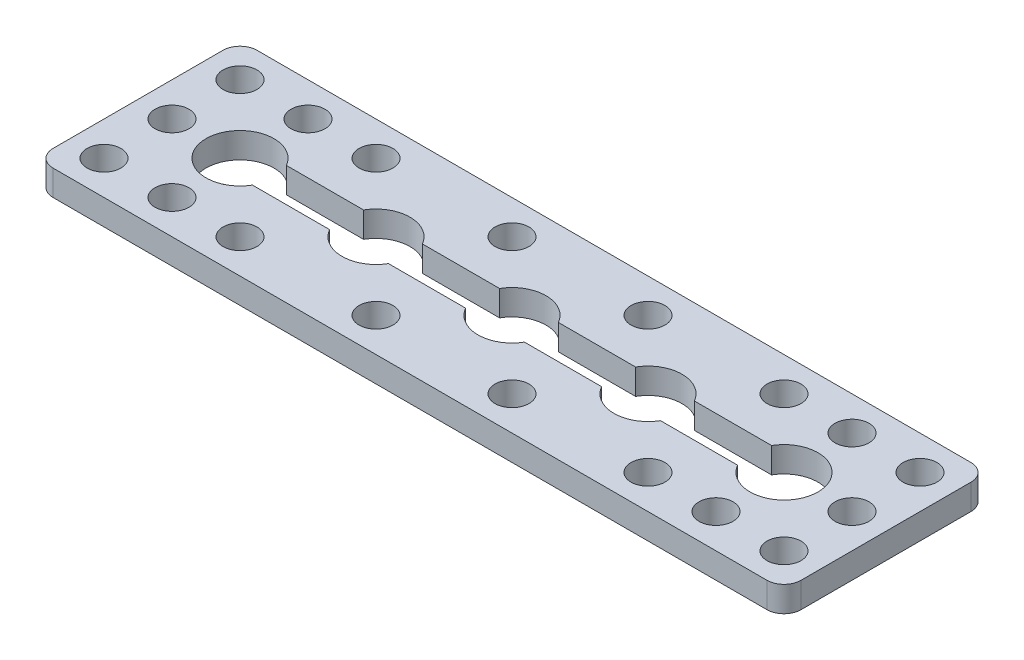
from build123d import *

# Parameters (mm, degrees)
SKETCH1_R           = 2
BOSS_EXTRUDE1_DEPTH = 3


with BuildPart() as part:
    # Sketch1 → Boss-Extrude1 (new body)
    # profile 1 of 4: a face of its own
    with BuildSketch(Plane(origin=(0, 0, 0), x_dir=(1, 0, 0), z_dir=(0, 1, 0))):
        with BuildLine():
            Line((-30.480543451, -12.568481461), (11.519456549, -12.568481461))
            Line((11.519456549, -12.568481461), (11.519456549, -4.568481461))
            ThreePointArc((11.519456549, -4.568481461), (9.519456549, -4.032583076), (8.055354934, -2.568481461))
            Line((8.055354934, -2.568481461), (-1.016441836, -2.568481461))
            ThreePointArc((-1.016441836, -2.568481461), (-4.480543451, -4.568481461), (-7.944645066, -2.568481461))
            Line((-7.944645066, -2.568481461), (-17.016441836, -2.568481461))
            ThreePointArc((-17.016441836, -2.568481461), (-21.515819631, -4.432184766), (-24.480543451, -0.568481461))
            Line((-24.480543451, -0.568481461), (-26.480543451, -0.568481461))
            ThreePointArc((-26.480543451, -0.568481461), (-28.480543451, -2.568481461), (-30.480543451, -0.568481461))
            Line((-30.480543451, -0.568481461), (-32.480543451, -0.568481461))
            Line((-32.480543451, -0.568481461), (-32.480543451, -10.568481461))
            ThreePointArc((-32.480543451, -10.568481461), (-31.894757013, -11.982695023), (-30.480543451, -12.568481461))
        make_face()
        with Locations(Location((-28.480543451, -8.568481461, 0), (0, 0, 270))):
            Circle(SKETCH1_R, mode=Mode.SUBTRACT)
        with Locations(Location((-20.480543451, -8.568481461, 0), (0, 0, 270))):
            Circle(SKETCH1_R, mode=Mode.SUBTRACT)
        with Locations(Location((-12.480543451, -8.568481461, 0), (0, 0, 270))):
            Circle(SKETCH1_R, mode=Mode.SUBTRACT)
        with Locations(Location((3.519456549, -8.568481461, 0), (0, 0, 270))):
            Circle(SKETCH1_R, mode=Mode.SUBTRACT)
    # profile 2 of 4: a face of its own
    with BuildSketch(Plane(origin=(0, 0, 0), x_dir=(1, 0, 0), z_dir=(0, 1, 0))):
        with BuildLine():
            Line((11.519456549, 3.431518539), (11.519456549, 11.431518539))
            Line((11.519456549, 11.431518539), (-30.480543451, 11.431518539))
            ThreePointArc((-30.480543451, 11.431518539), (-31.894757013, 10.845732102), (-32.480543451, 9.431518539))
            Line((-32.480543451, 9.431518539), (-32.480543451, -0.568481461))
            Line((-32.480543451, -0.568481461), (-30.480543451, -0.568481461))
            ThreePointArc((-30.480543451, -0.568481461), (-28.480543451, 1.431518539), (-26.480543451, -0.568481461))
            Line((-26.480543451, -0.568481461), (-24.480543451, -0.568481461))
            ThreePointArc((-24.480543451, -0.568481461), (-21.515819631, 3.295221845), (-17.016441836, 1.431518539))
            Line((-17.016441836, 1.431518539), (-7.944645066, 1.431518539))
            ThreePointArc((-7.944645066, 1.431518539), (-4.480543451, 3.431518539), (-1.016441836, 1.431518539))
            Line((-1.016441836, 1.431518539), (8.055354934, 1.431518539))
            ThreePointArc((8.055354934, 1.431518539), (9.519456549, 2.895620155), (11.519456549, 3.431518539))
        make_face()
        with Locations(Location((-28.480543451, 7.431518539, 0), (0, 0, 270))):
            Circle(SKETCH1_R, mode=Mode.SUBTRACT)
        with Locations(Location((-20.480543451, 7.431518539, 0), (0, 0, 270))):
            Circle(SKETCH1_R, mode=Mode.SUBTRACT)
        with Locations(Location((-12.480543451, 7.431518539, 0), (0, 0, 270))):
            Circle(SKETCH1_R, mode=Mode.SUBTRACT)
        with Locations(Location((3.519456549, 7.431518539, 0), (0, 0, 270))):
            Circle(SKETCH1_R, mode=Mode.SUBTRACT)
    # profile 3 of 4: a face of its own
    with BuildSketch(Plane(origin=(0, 0, 0), x_dir=(1, 0, 0), z_dir=(0, 1, 0))):
        with BuildLine():
            ThreePointArc((49.519456549, -0.568481461), (51.519456549, 1.431518539), (53.519456549, -0.568481461))
            Line((53.519456549, -0.568481461), (55.519456549, -0.568481461))
            Line((55.519456549, -0.568481461), (55.519456549, 9.431518539))
            ThreePointArc((55.519456549, 9.431518539), (54.933670112, 10.845732102), (53.519456549, 11.431518539))
            Line((53.519456549, 11.431518539), (11.519456549, 11.431518539))
            Line((11.519456549, 11.431518539), (11.519456549, 3.431518539))
            ThreePointArc((11.519456549, 3.431518539), (13.519456549, 2.895620155), (14.983558164, 1.431518539))
            Line((14.983558164, 1.431518539), (24.055354934, 1.431518539))
            ThreePointArc((24.055354934, 1.431518539), (27.519456549, 3.431518539), (30.983558164, 1.431518539))
            Line((30.983558164, 1.431518539), (40.055354934, 1.431518539))
            ThreePointArc((40.055354934, 1.431518539), (44.55473273, 3.295221845), (47.519456549, -0.568481461))
            Line((47.519456549, -0.568481461), (49.519456549, -0.568481461))
        make_face()
        with Locations(Location((19.519456549, 7.431518539, 0), (0, 0, 270))):
            Circle(SKETCH1_R, mode=Mode.SUBTRACT)
        with Locations(Location((35.519456549, 7.431518539, 0), (0, 0, 270))):
            Circle(SKETCH1_R, mode=Mode.SUBTRACT)
        with Locations(Location((43.519456549, 7.431518539, 0), (0, 0, 270))):
            Circle(SKETCH1_R, mode=Mode.SUBTRACT)
        with Locations(Location((51.519456549, 7.431518539, 0), (0, 0, 270))):
            Circle(SKETCH1_R, mode=Mode.SUBTRACT)
    # profile 4 of 4: a face of its own
    with BuildSketch(Plane(origin=(0, 0, 0), x_dir=(1, 0, 0), z_dir=(0, 1, 0))):
        with BuildLine():
            Line((55.519456549, -0.568481461), (53.519456549, -0.568481461))
            ThreePointArc((53.519456549, -0.568481461), (51.519456549, -2.568481461), (49.519456549, -0.568481461))
            Line((49.519456549, -0.568481461), (47.519456549, -0.568481461))
            ThreePointArc((47.519456549, -0.568481461), (44.55473273, -4.432184766), (40.055354934, -2.568481461))
            Line((40.055354934, -2.568481461), (30.983558164, -2.568481461))
            ThreePointArc((30.983558164, -2.568481461), (27.519456549, -4.568481461), (24.055354934, -2.568481461))
            Line((24.055354934, -2.568481461), (14.983558164, -2.568481461))
            ThreePointArc((14.983558164, -2.568481461), (13.519456549, -4.032583076), (11.519456549, -4.568481461))
            Line((11.519456549, -4.568481461), (11.519456549, -12.568481461))
            Line((11.519456549, -12.568481461), (53.519456549, -12.568481461))
            ThreePointArc((53.519456549, -12.568481461), (54.933670112, -11.982695023), (55.519456549, -10.568481461))
            Line((55.519456549, -10.568481461), (55.519456549, -0.568481461))
        make_face()
        with Locations(Location((19.519456549, -8.568481461, 0), (0, 0, 270))):
            Circle(SKETCH1_R, mode=Mode.SUBTRACT)
        with Locations(Location((35.519456549, -8.568481461, 0), (0, 0, 270))):
            Circle(SKETCH1_R, mode=Mode.SUBTRACT)
        with Locations(Location((43.519456549, -8.568481461, 0), (0, 0, 270))):
            Circle(SKETCH1_R, mode=Mode.SUBTRACT)
        with Locations(Location((51.519456549, -8.568481461, 0), (0, 0, 270))):
            Circle(SKETCH1_R, mode=Mode.SUBTRACT)
    extrude(amount=BOSS_EXTRUDE1_DEPTH)


solid = part.part
